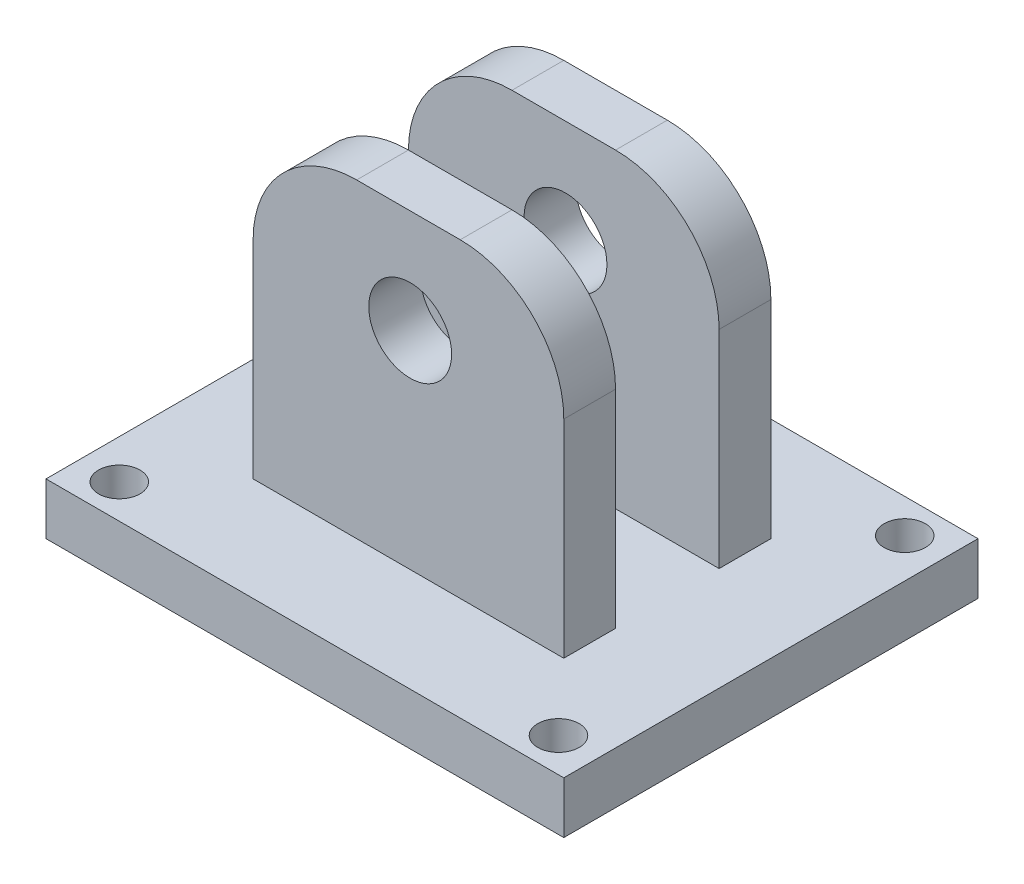
from build123d import *

# Parameters (mm, degrees)
SKETCH1_W           = 50
SKETCH1_H           = 40
BOSS_EXTRUDE1_DEPTH = 5
SKETCH2_W           = 30
SKETCH2_H           = 5
BOSS_EXTRUDE2_DEPTH = 35
FILLET1_R           = 10
FILLET2_R           = 10
FILLET3_R           = 10
FILLET4_R           = 10
SKETCH3_R           = 4
CUT_EXTRUDE1_DEPTH  = 35
SKETCH5_R           = 2
CUT_EXTRUDE3_DEPTH  = 35
SKETCH5_4_R         = 2
CUT_EXTRUDE4_DEPTH  = 35


with BuildPart() as part:
    # Sketch1 → Boss-Extrude1 (new body)
    with BuildSketch(Plane(origin=(0, 0, 0), x_dir=(1, 0, 0), z_dir=(0, 1, 0))):
        with Locations((2.66798419, -7.845849802)):
            Rectangle(SKETCH1_W, SKETCH1_H)
    extrude(amount=BOSS_EXTRUDE1_DEPTH)

    # Sketch2 → Boss-Extrude2 (add)
    with BuildSketch(Plane(origin=(0, 0, 0), x_dir=(1, 0, 0), z_dir=(0, 1, 0))):
        with Locations((2.66798419, -15.345849802)):
            Rectangle(SKETCH2_W, SKETCH2_H)
        with Locations((2.66798419, -0.345849802)):
            Rectangle(SKETCH2_W, SKETCH2_H)
    extrude(amount=BOSS_EXTRUDE2_DEPTH)

    # Fillet1
    fillet1_edges = [part.edges().sort_by_distance(p)[0] for p in [
        (17.66798419, 35, 15.345849802),
    ]]
    fillet(fillet1_edges, radius=FILLET1_R)

    # Fillet2
    fillet2_edges = [part.edges().sort_by_distance(p)[0] for p in [
        (-12.33201581, 35, 15.345849802),
    ]]
    fillet(fillet2_edges, radius=FILLET2_R)

    # Fillet3
    fillet3_edges = [part.edges().sort_by_distance(p)[0] for p in [
        (-12.33201581, 35, 0.345849802),
    ]]
    fillet(fillet3_edges, radius=FILLET3_R)

    # Fillet4
    fillet4_edges = [part.edges().sort_by_distance(p)[0] for p in [
        (17.66798419, 35, 0.345849802),
    ]]
    fillet(fillet4_edges, radius=FILLET4_R)

    # Sketch3 → Cut-Extrude1 (cut)
    with BuildSketch(Plane.XY.offset(17.845849802)):
        with Locations((2.834176639, 25)):
            Circle(SKETCH3_R)
    extrude(amount=-CUT_EXTRUDE1_DEPTH, mode=Mode.SUBTRACT)

    # Sketch5 → Cut-Extrude3 (cut)
    with BuildSketch(Plane(origin=(0, 5, 0), x_dir=(1, 0, 0), z_dir=(0, 1, 0))):
        with Locations(Location((-18.537983824, 8.872799407, 0), (0, 0, 270))):
            Circle(SKETCH5_R)
    extrude(amount=-CUT_EXTRUDE3_DEPTH, mode=Mode.SUBTRACT)

    # Sketch5<4> → Cut-Extrude4 (cut)
    with BuildSketch(Plane(origin=(0, 5, 0), x_dir=(1, 0, 0), z_dir=(0, 1, 0))):
        with Locations(Location((23.873952204, -24.564499012, 0), (0, 0, 270))):
            Circle(SKETCH5_4_R)
        with Locations(Location((-18.537983824, -24.564499012, 0), (0, 0, 270))):
            Circle(SKETCH5_4_R)
        with Locations(Location((23.873952204, 8.872799407, 0), (0, 0, 270))):
            Circle(SKETCH5_4_R)
        with Locations(Location((-18.537983824, 8.872799407, 0), (0, 0, 270))):
            Circle(SKETCH5_4_R)
    extrude(amount=-CUT_EXTRUDE4_DEPTH, mode=Mode.SUBTRACT)


solid = part.part
